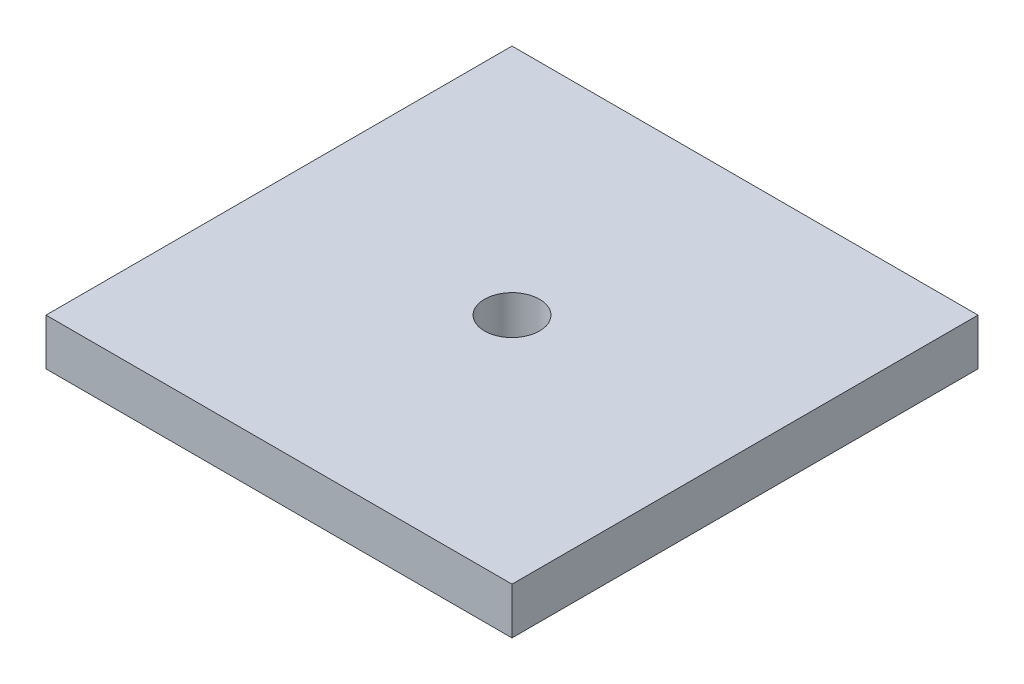
from build123d import *

# Parameters (mm, degrees)
SKETCH1_W           = 127
SKETCH1_H           = 127
SKETCH1_R           = 7.5057
BOSS_EXTRUDE1_DEPTH = 12.7


with BuildPart() as part:
    # Sketch1 → Boss-Extrude1 (new body)
    with BuildSketch(Plane(origin=(0, 0, 0), x_dir=(1, 0, 0), z_dir=(0, 1, 0))):
        Rectangle(SKETCH1_W, SKETCH1_H)
        with Locations(Location((0, 0, 0), (0, 0, 270))):
            Circle(SKETCH1_R, mode=Mode.SUBTRACT)
    extrude(amount=BOSS_EXTRUDE1_DEPTH)


solid = part.part
